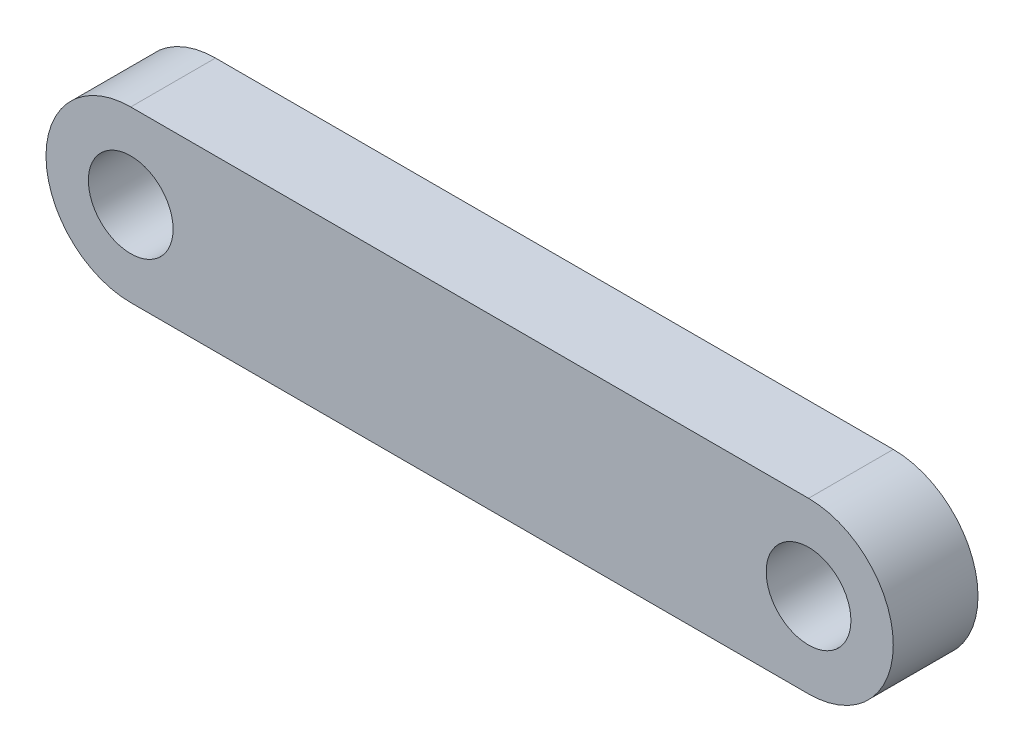
from build123d import *

# Parameters (mm, degrees)
SKETCH_1_R      = 1
EXTRUDE_1_DEPTH = 2


with BuildPart() as part:
    # 草圖1 → 填料-伸長1 (new body)
    with BuildSketch(Plane.XY):
        with BuildLine():
            Line((-7.999999989, 2.00041278), (8.000000011, 2.00041278))
            ThreePointArc((8.000000011, 2.00041278), (10.000000011, 0.00041278), (8.000000011, -1.99958722))
            Line((8.000000011, -1.99958722), (-7.999999989, -1.99958722))
            ThreePointArc((-7.999999989, -1.99958722), (-9.999999989, 0.00041278), (-7.999999989, 2.00041278))
        make_face()
        with Locations((-7.999999989, 0.00041278)):
            Circle(SKETCH_1_R, mode=Mode.SUBTRACT)
        with Locations((8.000000011, 0.00041278)):
            Circle(SKETCH_1_R, mode=Mode.SUBTRACT)
    extrude(amount=EXTRUDE_1_DEPTH)


solid = part.part
